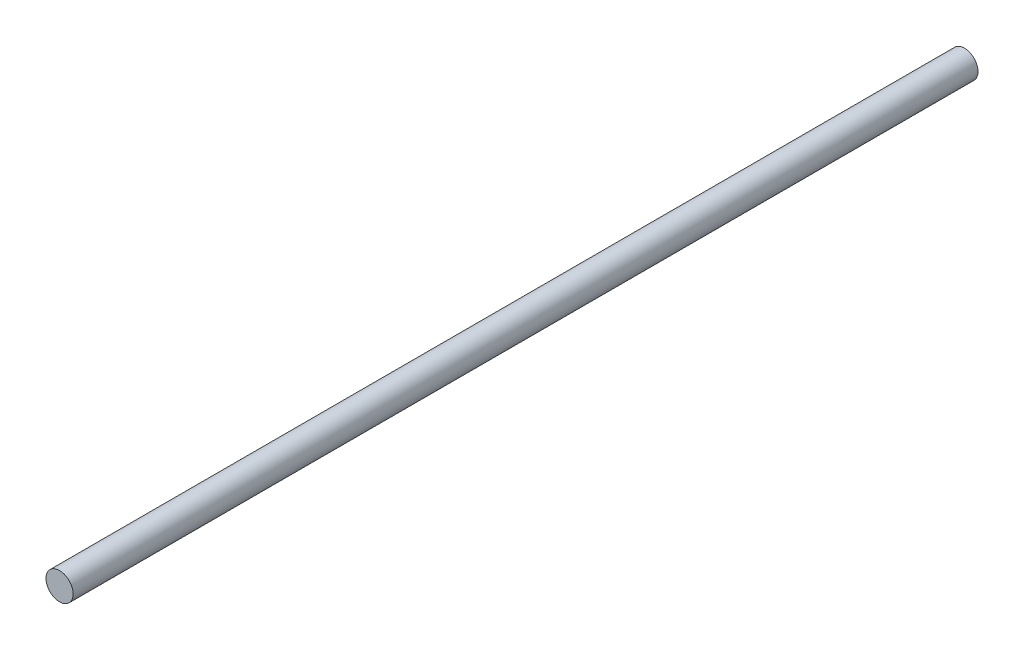
from build123d import *

# Parameters (mm, degrees)
ESQUISSE1_R        = 1.5
BOSS_EXTRU_1_DEPTH = 100


with BuildPart() as part:
    # Esquisse1 → Boss.-Extru.1 (new body)
    with BuildSketch(Plane.XY):
        Circle(ESQUISSE1_R)
    extrude(amount=BOSS_EXTRU_1_DEPTH)


solid = part.part
